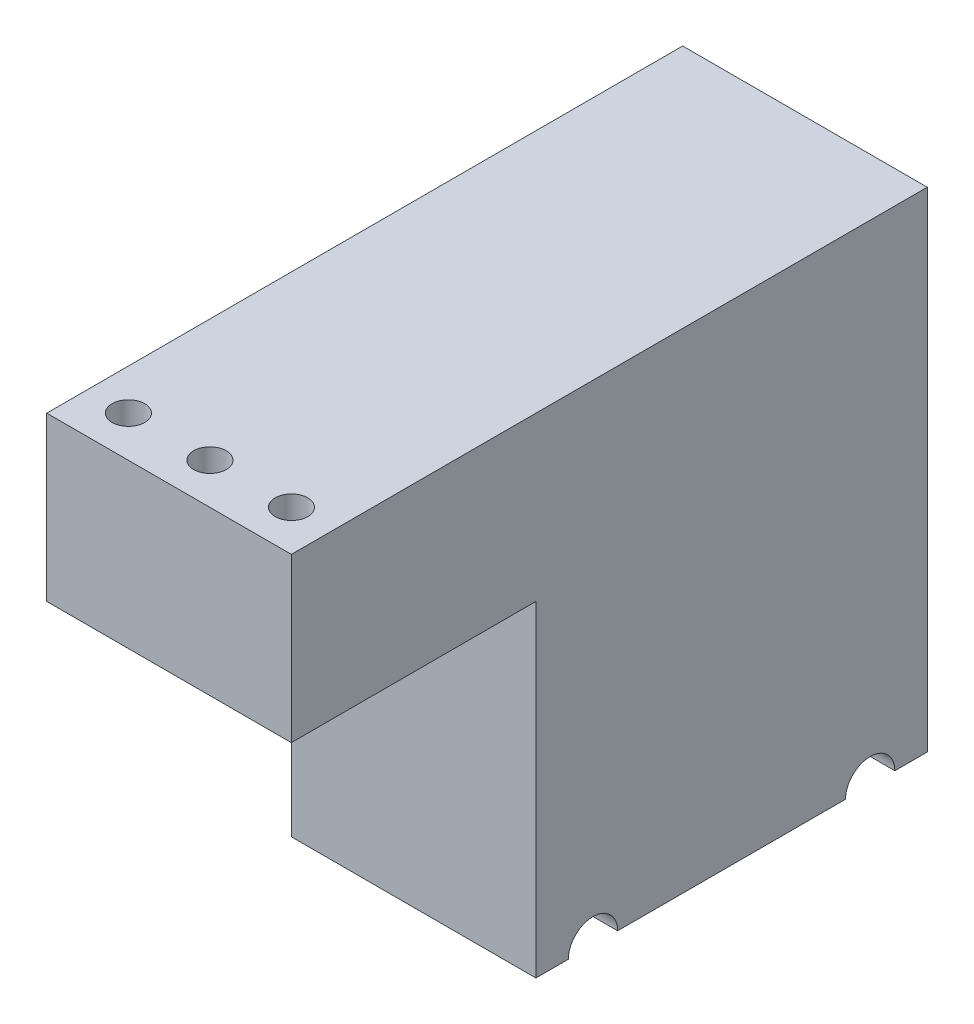
from build123d import *

# Parameters (mm, degrees)
SKETCH_1_W          = 30
SKETCH_1_H          = 95
EXTRUDE_1_DEPTH     = 48
SKETCH_2_R          = 3.025
SKETCH_2_R_2        = 3.005
CUT_EXTRUDE_1_DEPTH = 46
SKETCH_3_W          = 30
SKETCH_3_H          = 20
EXTRUDE_2_DEPTH     = 30
SKETCH_4_R          = 2
CUT_EXTRUDE_2_DEPTH = 5
SKETCH_5_W          = 48
SKETCH_5_H          = 35
CUT_EXTRUDE_3_DEPTH = 127.526677029
SKETCH_6_R          = 2
CUT_EXTRUDE_4_DEPTH = 5


with BuildPart() as part:
    # 草图1 → 凸台-拉伸1 (new body)
    with BuildSketch(Plane.XY):
        with Locations((15, 47.5)):
            Rectangle(SKETCH_1_W, SKETCH_1_H)
    extrude(amount=EXTRUDE_1_DEPTH)

    # 草图2 → 切除-拉伸1 (cut)
    # profile 1 of 2: a face of its own
    with BuildSketch(Plane.ZY):
        with Locations((7, 35)):
            Circle(SKETCH_2_R)
        with Locations((7, 35)):
            Circle(SKETCH_2_R_2, mode=Mode.SUBTRACT)
    # profile 2 of 2: a face of its own
    with BuildSketch(Plane.ZY):
        with Locations((41, 35)):
            Circle(SKETCH_2_R)
        with Locations((41, 35)):
            Circle(SKETCH_2_R_2, mode=Mode.SUBTRACT)
    extrude(amount=-CUT_EXTRUDE_1_DEPTH, mode=Mode.SUBTRACT)


with BuildPart() as cut_extrude_1_kept_piece:
    # of the separate pieces the step leaves, the one the design keeps (cut_extrude_1_pieces_kept)
    add(part.part.solids().sort_by_distance((0, 0, 0))[0])

    # 草图3 → 凸台-拉伸2 (add)
    with BuildSketch(Plane.XY.offset(48)):
        with Locations((15, 85)):
            Rectangle(SKETCH_3_W, SKETCH_3_H)
    extrude(amount=EXTRUDE_2_DEPTH)

    # 草图4 → 切除-拉伸2 (cut)
    with BuildSketch(Plane(origin=(0, 95, 0), x_dir=(1, 0, 0), z_dir=(0, 1, 0))):
        with Locations(Location((5, -72.983651548, 0), (0, 0, 270))):
            Circle(SKETCH_4_R)
        with Locations(Location((15, -72.983651548, 0), (0, 0, 270))):
            Circle(SKETCH_4_R)
        with Locations(Location((25, -72.983651548, 0), (0, 0, 270))):
            Circle(SKETCH_4_R)
    extrude(amount=-CUT_EXTRUDE_2_DEPTH, mode=Mode.SUBTRACT)

    # 草图5 → 切除-拉伸3 (cut, through all)
    with BuildSketch(Plane.ZY):
        with Locations((24, 17.5)):
            Rectangle(SKETCH_5_W, SKETCH_5_H)
    extrude(amount=-CUT_EXTRUDE_3_DEPTH, mode=Mode.SUBTRACT)

    # 草图6 → 切除-拉伸4 (cut)
    with BuildSketch(Plane.XZ.offset(-35)):
        with Locations(Location((6, 31.975, 0), (0, 0, 270))):
            Circle(SKETCH_6_R)
        with Locations(Location((12, 31.975, 0), (0, 0, 270))):
            Circle(SKETCH_6_R)
        with Locations(Location((18, 31.975, 0), (0, 0, 270))):
            Circle(SKETCH_6_R)
        with Locations(Location((24, 31.975, 0), (0, 0, 270))):
            Circle(SKETCH_6_R)
        with Locations(Location((6, 16.025, 0), (0, 0, 270))):
            Circle(SKETCH_6_R)
        with Locations(Location((12, 16.025, 0), (0, 0, 270))):
            Circle(SKETCH_6_R)
        with Locations(Location((18, 16.025, 0), (0, 0, 270))):
            Circle(SKETCH_6_R)
        with Locations(Location((24, 16.025, 0), (0, 0, 270))):
            Circle(SKETCH_6_R)
    extrude(amount=-CUT_EXTRUDE_4_DEPTH, mode=Mode.SUBTRACT)


solid = cut_extrude_1_kept_piece.part
